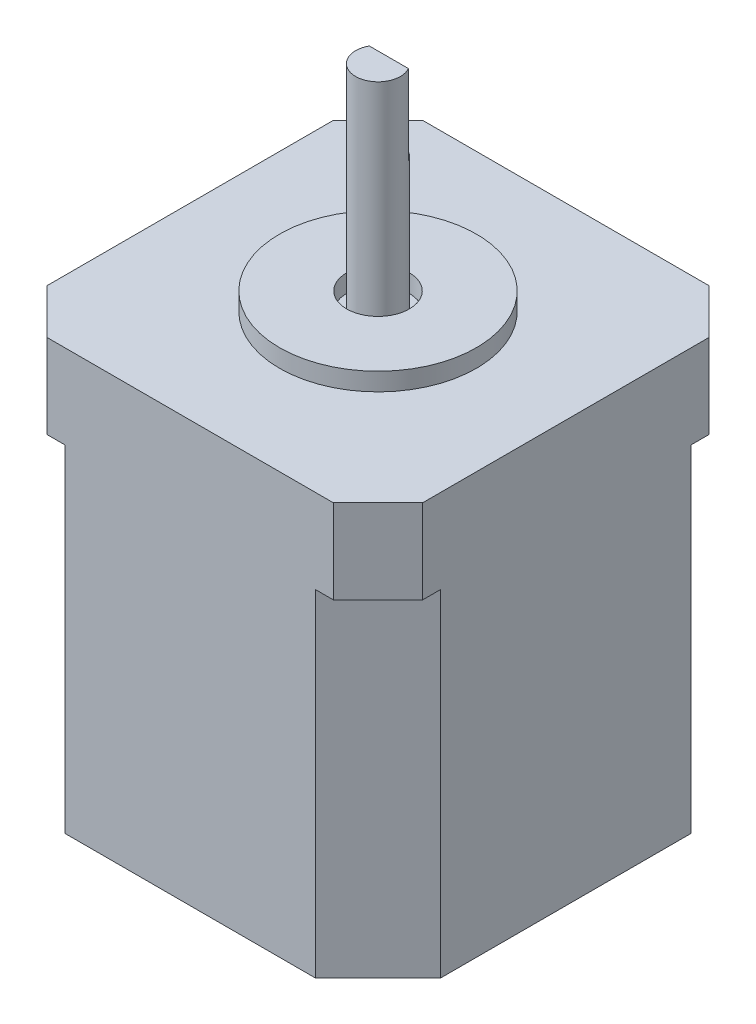
from build123d import *

# Parameters (mm, degrees)
SKETCH4_W               = 42
SKETCH4_H               = 42
BOTTOM_DEPTH            = 9.4
CHAMFER2_SIZE           = 5
SKETCH6_W               = 42
SKETCH6_H               = 42
MIDDLE_DEPTH            = 28.2
CHAMFER3_SIZE           = 7
SKETCH8_W               = 42
SKETCH8_H               = 42
TOP_DEPTH               = 9.4
CHAMFER4_SIZE           = 5
SKETCH9_R               = 11
SKETCH9_R_2             = 3.5
BOSS_EXTRUDE4_DEPTH     = 2
SKETCH10_R              = 2.5
SHAFT_DEPTH             = 24
CUT_EXTRUDE3_DEPTH      = 5
CUT_EXTRUDE3_DEPTH_BACK = 5
SKETCH11_W              = 2.239647547
SKETCH11_H              = 11.242457261


with BuildPart() as part:
    # Sketch4 → Bottom (new body)
    with BuildSketch(Plane(origin=(0, 0, 0), x_dir=(1, 0, 0), z_dir=(0, 1, 0))):
        Rectangle(SKETCH4_W, SKETCH4_H)
    extrude(amount=BOTTOM_DEPTH)

    # Chamfer2
    chamfer2_edges = [part.edges().sort_by_distance(p)[0] for p in [
        (-21, 4.7, 21),
        (-21, 4.7, -21),
        (21, 4.7, -21),
        (21, 4.7, 21),
    ]]
    chamfer(chamfer2_edges, length=CHAMFER2_SIZE)

    # Sketch6 → Middle (add)
    with BuildSketch(Plane(origin=(0, 9.4, 0), x_dir=(1, 0, 0), z_dir=(0, 1, 0))):
        Rectangle(SKETCH6_W, SKETCH6_H)
    extrude(amount=MIDDLE_DEPTH)

    # Chamfer3
    chamfer3_edges = [part.edges().sort_by_distance(p)[0] for p in [
        (21, 23.5, 21),
        (-21, 23.5, 21),
        (-21, 23.5, -21),
        (21, 23.5, -21),
    ]]
    chamfer(chamfer3_edges, length=CHAMFER3_SIZE)

    # Sketch8 → Top (add)
    with BuildSketch(Plane(origin=(0, 37.6, 0), x_dir=(1, 0, 0), z_dir=(0, 1, 0))):
        Rectangle(SKETCH8_W, SKETCH8_H)
    extrude(amount=TOP_DEPTH)

    # Chamfer4
    chamfer4_edges = [part.edges().sort_by_distance(p)[0] for p in [
        (21, 42.3, 21),
        (21, 42.3, -21),
        (-21, 42.3, -21),
        (-21, 42.3, 21),
    ]]
    chamfer(chamfer4_edges, length=CHAMFER4_SIZE)

    # Sketch9 → Boss-Extrude4 (add)
    with BuildSketch(Plane(origin=(0, 47, 0), x_dir=(1, 0, 0), z_dir=(0, 1, 0))):
        with Locations(Location((0, 0, 0), (0, 0, 270))):
            Circle(SKETCH9_R)
        with Locations(Location((0, 0, 0), (0, 0, 270))):
            Circle(SKETCH9_R_2, mode=Mode.SUBTRACT)
    extrude(amount=BOSS_EXTRUDE4_DEPTH)

    # Sketch10 → Shaft (add)
    with BuildSketch(Plane(origin=(0, 47, 0), x_dir=(1, 0, 0), z_dir=(0, 1, 0))):
        with Locations(Location((0, 0, 0), (0, 0, 90))):
            Circle(SKETCH10_R)
    extrude(amount=SHAFT_DEPTH)

    # Sketch11 → Cut-Extrude3 (cut, two sides: drawn at the far end of the back side and taken through both)
    with BuildSketch(Plane(origin=(0, 0, 0), x_dir=(0, 0, -1), z_dir=(1, 0, 0)).offset(-CUT_EXTRUDE3_DEPTH_BACK)):
        with Locations((2.338622492, 67.62122863)):
            Rectangle(SKETCH11_W, SKETCH11_H)
    extrude(amount=CUT_EXTRUDE3_DEPTH + CUT_EXTRUDE3_DEPTH_BACK, mode=Mode.SUBTRACT)


solid = part.part
